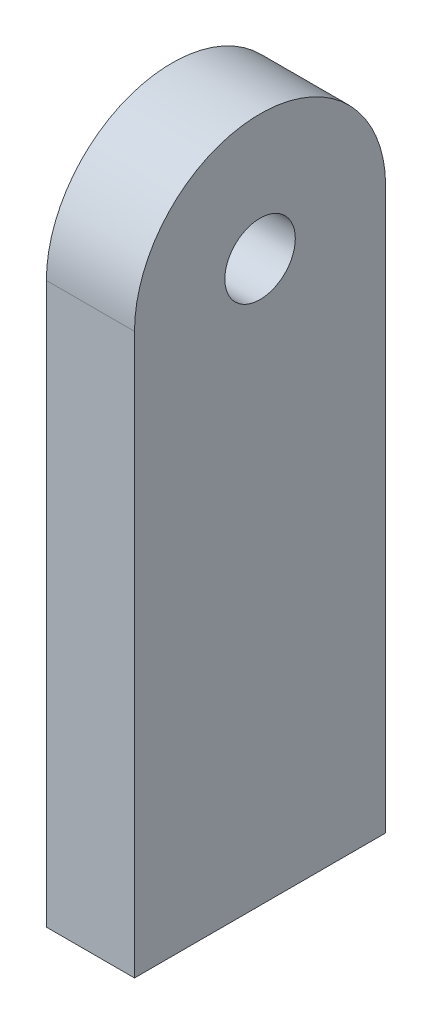
from build123d import *

# Parameters (mm, degrees)
SKETCH_1_R      = 4
EXTRUDE_1_DEPTH = 10


with BuildPart() as part:
    # Эскиз1 → Вытянуть1 (new body)
    with BuildSketch(Plane(origin=(0, 0, 0), x_dir=(0, 0, -1), z_dir=(1, 0, 0))):
        with BuildLine():
            Line((21.5, -78.737447295), (50, -78.737447295))
            Line((50, -78.737447295), (50, -15))
            ThreePointArc((50, -15), (35.657600396, -0.935705761), (21.5, -15.186009262))
            Line((21.5, -15.186009262), (21.5, -78.737447295))
        make_face()
        with Locations((35.75, -15.186009262)):
            Circle(SKETCH_1_R, mode=Mode.SUBTRACT)
    extrude(amount=EXTRUDE_1_DEPTH)


solid = part.part
